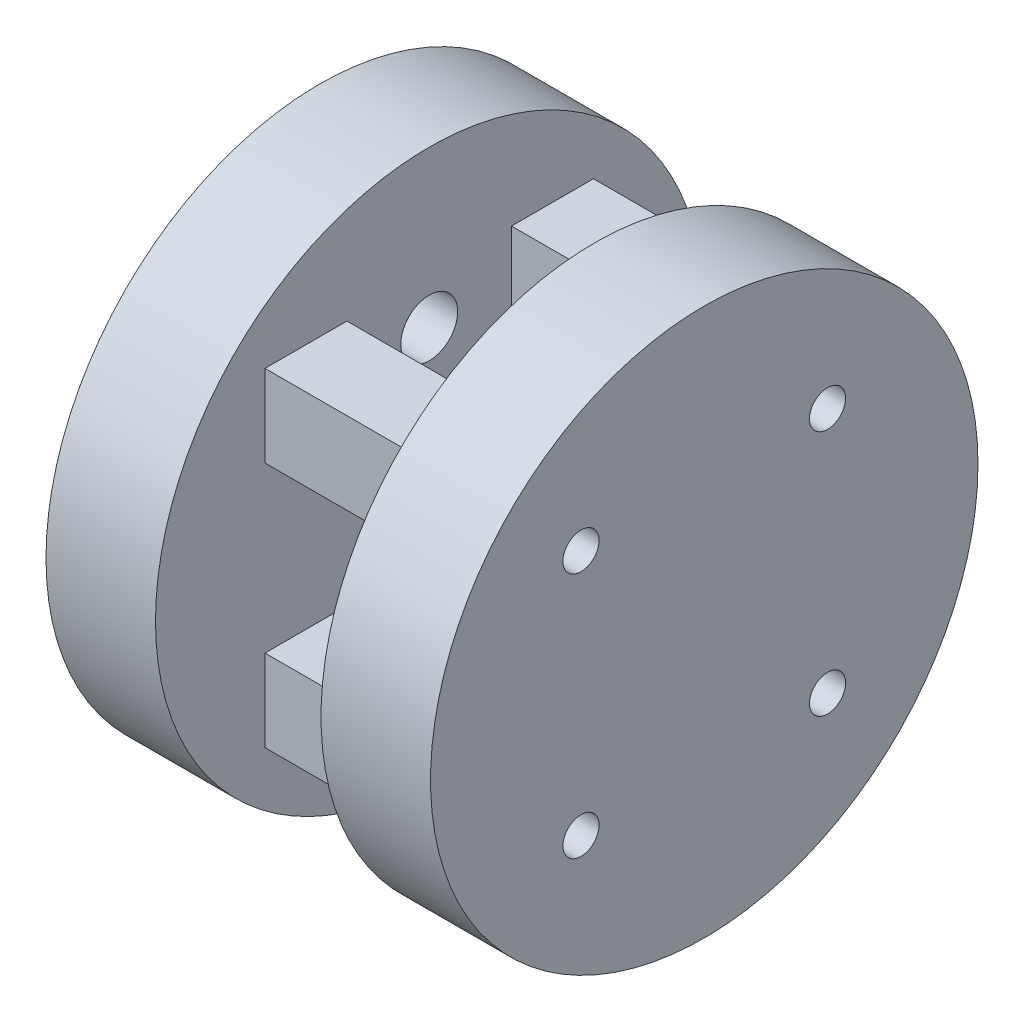
from build123d import *

# Parameters (mm, degrees)
SKETCH1_W           = 30
SKETCH1_H           = 30
BOSS_EXTRUDE1_DEPTH = 10
SKETCH2_W           = 7.484
SKETCH2_H           = 7.484
BOSS_EXTRUDE2_DEPTH = 15.12
SKETCH3_R           = 2.596307875
CUT_EXTRUDE1_DEPTH  = 27.050228406
SKETCH4_R           = 25
SKETCH4_W           = 30
SKETCH4_H           = 30
BOSS_EXTRUDE4_DEPTH = 10
SKETCH5_R           = 25
BOSS_EXTRUDE5_DEPTH = 10
SKETCH6_R           = 1.45
CUT_EXTRUDE2_DEPTH  = 10
SKETCH7_R           = 1.65
CUT_EXTRUDE3_DEPTH  = 50.833868002
SKETCH8_R           = 1.45
CUT_EXTRUDE4_DEPTH  = 10


with BuildPart() as part:
    # Sketch1 → Boss-Extrude1 (new body)
    with BuildSketch(Plane(origin=(0, 0, 0), x_dir=(0, 0, -1), z_dir=(1, 0, 0))):
        Rectangle(SKETCH1_W, SKETCH1_H)
    extrude(amount=BOSS_EXTRUDE1_DEPTH)

    # Sketch2 → Boss-Extrude2 (add)
    with BuildSketch(Plane(origin=(10, 0, 0), x_dir=(0, 0, -1), z_dir=(1, 0, 0))):
        with Locations((-11.258, 11.258)):
            Rectangle(SKETCH2_W, SKETCH2_H)
        with Locations((11.258, 11.258)):
            Rectangle(SKETCH2_W, SKETCH2_H)
        with Locations((11.258, -11.258)):
            Rectangle(SKETCH2_W, SKETCH2_H)
        with Locations((-11.258, -11.258)):
            Rectangle(SKETCH2_W, SKETCH2_H)
    extrude(amount=BOSS_EXTRUDE2_DEPTH)

    # Sketch3 → Cut-Extrude1 (cut, through all)
    with BuildSketch(Plane(origin=(10, 0, 0), x_dir=(0, 0, -1), z_dir=(1, 0, 0))):
        with Locations((0, 10.7)):
            Circle(SKETCH3_R)
        with Locations((0, -10.7)):
            Circle(SKETCH3_R)
        Circle(SKETCH3_R)
    extrude(amount=-CUT_EXTRUDE1_DEPTH, mode=Mode.SUBTRACT)

    # Sketch4 → Boss-Extrude4 (add)
    with BuildSketch(Plane.ZY):
        Circle(SKETCH4_R)
        Rectangle(SKETCH4_W, SKETCH4_H, mode=Mode.SUBTRACT)
    extrude(amount=-BOSS_EXTRUDE4_DEPTH)

    # Sketch8 → Cut-Extrude4 (cut)
    with BuildSketch(Plane(origin=(25.12, 0, 0), x_dir=(0, 0, -1), z_dir=(1, 0, 0))):
        with Locations((-11.258, 11.258)):
            Circle(SKETCH8_R)
        with Locations((-11.258, -11.258)):
            Circle(SKETCH8_R)
        with Locations((11.258, 11.258)):
            Circle(SKETCH8_R)
        with Locations((11.258, -11.258)):
            Circle(SKETCH8_R)
    extrude(amount=-CUT_EXTRUDE4_DEPTH, mode=Mode.SUBTRACT)


with BuildPart() as body_2:
    # Sketch5 → Boss-Extrude5 (new body)
    with BuildSketch(Plane(origin=(25.12, 0, 0), x_dir=(0, 0, -1), z_dir=(1, 0, 0))):
        Circle(SKETCH5_R)
    extrude(amount=BOSS_EXTRUDE5_DEPTH)

    # Sketch6 → Cut-Extrude2 (cut)
    with BuildSketch(Plane(origin=(35.12, 0, 0), x_dir=(0, 0, -1), z_dir=(1, 0, 0))):
        with Locations((-11.258, 11.258)):
            Circle(SKETCH6_R)
        with Locations((-11.258, -11.258)):
            Circle(SKETCH6_R)
        with Locations((11.258, -11.258)):
            Circle(SKETCH6_R)
        with Locations((11.258, 11.258)):
            Circle(SKETCH6_R)
    extrude(amount=-CUT_EXTRUDE2_DEPTH, mode=Mode.SUBTRACT)

    # Sketch7 → Cut-Extrude3 (cut, through all)
    with BuildSketch(Plane(origin=(35.12, 0, 0), x_dir=(0, 0, -1), z_dir=(1, 0, 0))):
        with Locations((11.258, -11.258)):
            Circle(SKETCH7_R)
        with Locations((-11.258, 11.258)):
            Circle(SKETCH7_R)
        with Locations((-11.258, -11.258)):
            Circle(SKETCH7_R)
        with Locations((11.258, 11.258)):
            Circle(SKETCH7_R)
    extrude(amount=-CUT_EXTRUDE3_DEPTH, mode=Mode.SUBTRACT)


solid = Compound([part.part, body_2.part])
